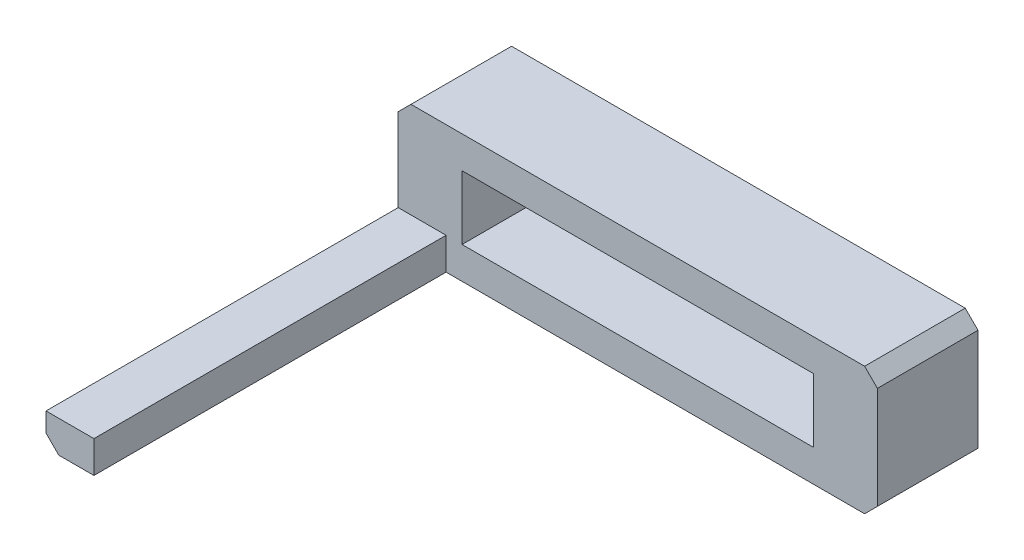
from build123d import *

# Parameters (mm, degrees)
SKETCH1_W           = 95.25
SKETCH1_H           = 25.4
SKETCH1_W_2         = 69.85
SKETCH1_H_2         = 12.7
BOSS_EXTRUDE1_DEPTH = 20
SKETCH2_W           = 9.525
SKETCH2_H           = 6.35
BOSS_EXTRUDE2_DEPTH = 70
CHAMFER1_SIZE       = 2.54


with BuildPart() as part:
    # Sketch1 → Boss-Extrude1 (new body)
    with BuildSketch(Plane.XY):
        with Locations((-47.625, 12.7)):
            Rectangle(SKETCH1_W, SKETCH1_H)
        with Locations((-47.625, 12.7)):
            Rectangle(SKETCH1_W_2, SKETCH1_H_2, mode=Mode.SUBTRACT)
    extrude(amount=BOSS_EXTRUDE1_DEPTH)

    # Sketch2 → Boss-Extrude2 (add)
    with BuildSketch(Plane.XY.offset(20)):
        with Locations((-90.4875, 3.175)):
            Rectangle(SKETCH2_W, SKETCH2_H)
    extrude(amount=BOSS_EXTRUDE2_DEPTH)

    # Chamfer1
    chamfer1_edges = [part.edges().sort_by_distance(p)[0] for p in [
        (-95.25, 25.4, 10),
        (0, 25.4, 10),
        (0, 0, 10),
        (-95.25, 0, 45),
    ]]
    chamfer(chamfer1_edges, length=CHAMFER1_SIZE)


solid = part.part
